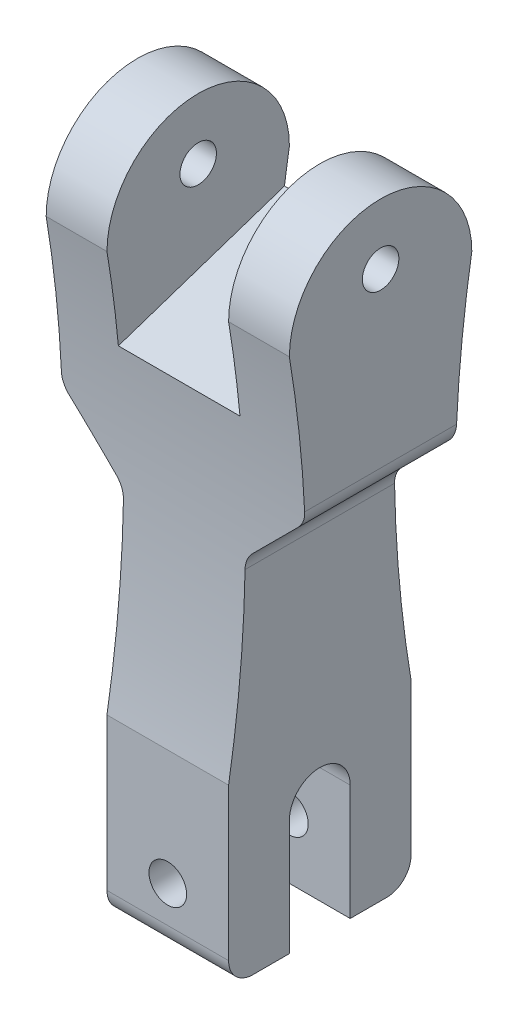
from build123d import *

# Parameters (mm, degrees)
CROQUIS1_R              = 1.55
SALIENTE_EXTRUIR1_DEPTH = 15
REDONDEO1_R             = 2
CROQUIS10_R             = 1.5
CORTAR_EXTRUIR1_DEPTH   = 56.90169959


with BuildPart() as part:
    # Croquis1 → Saliente-Extruir1 (new body)
    with BuildSketch(Plane.XY):
        Polygon((-5, 25), (-10, 30), (-10, 50), (10, 50), (10, 30), (5, 25), (5, -5), (-5, -5), align=None)
        Circle(CROQUIS1_R, mode=Mode.SUBTRACT)
    extrude(amount=SALIENTE_EXTRUIR1_DEPTH)

    # Croquis8 → Cortar-Recubrir1 section 0
    with BuildSketch(Plane.XY.offset(15)):
        with BuildLine():
            Line((5, 50), (-5, 50))
            Line((-5, 50), (-5, 35))
            Line((-5, 35), (5, 35))
            Line((5, 35), (5, 50))
        make_face()
    # Croquis9 → Cortar-Recubrir1 section 1
    with BuildSketch(Plane(origin=(0, 0, 0), x_dir=(-1, 0, 0), z_dir=(0, 0, -1))):
        with BuildLine():
            Line((5, 50), (-5, 50))
            Line((-5, 50), (-5, 40))
            Line((-5, 40), (5, 40))
            Line((5, 40), (5, 50))
        make_face()
    loft(mode=Mode.SUBTRACT)

    # Redondeo1
    redondeo1_edges = [part.edges().sort_by_distance(p)[0] for p in [
        (0, -5, 0),
        (5, 25, 7.5),
        (-5, 25, 7.5),
        (-10, 30, 7.5),
        (10, 30, 7.5),
        (0, -5, 15),
    ]]
    fillet(redondeo1_edges, radius=REDONDEO1_R)

    # Croquis10 → Cortar-Extruir1 (cut, through all)
    with BuildSketch(Plane(origin=(10, 0, 0), x_dir=(0, 0, -1), z_dir=(1, 0, 0))):
        with Locations(Location((-7.5, 45, 0), (0, 0, 90))):
            Circle(CROQUIS10_R)
        with BuildLine():
            Line((-10, -5), (-10, 4.5))
            ThreePointArc((-10, 4.5), (-7.5, 7), (-5, 4.5))
            Line((-5, 4.5), (-5, -5))
            ThreePointArc((-5, -5), (-7.5, -7.5), (-10, -5))
        make_face()
        with BuildLine():
            Line((-17.5, 9.5), (-15, 9.5))
            ThreePointArc((-15, 9.5), (-13.629356685, 26), (-15, 42.5))
            ThreePointArc((-15, 42.5), (-7.5, 50), (0, 42.5))
            ThreePointArc((0, 42.5), (-1.370643315, 26), (0, 9.5))
            Line((0, 9.5), (2.5, 9.5))
            Line((2.5, 9.5), (2.5, 51.5))
            Line((2.5, 51.5), (-17.5, 51.5))
            Line((-17.5, 51.5), (-17.5, 9.5))
        make_face()
    extrude(amount=-CORTAR_EXTRUIR1_DEPTH, mode=Mode.SUBTRACT)


solid = part.part
